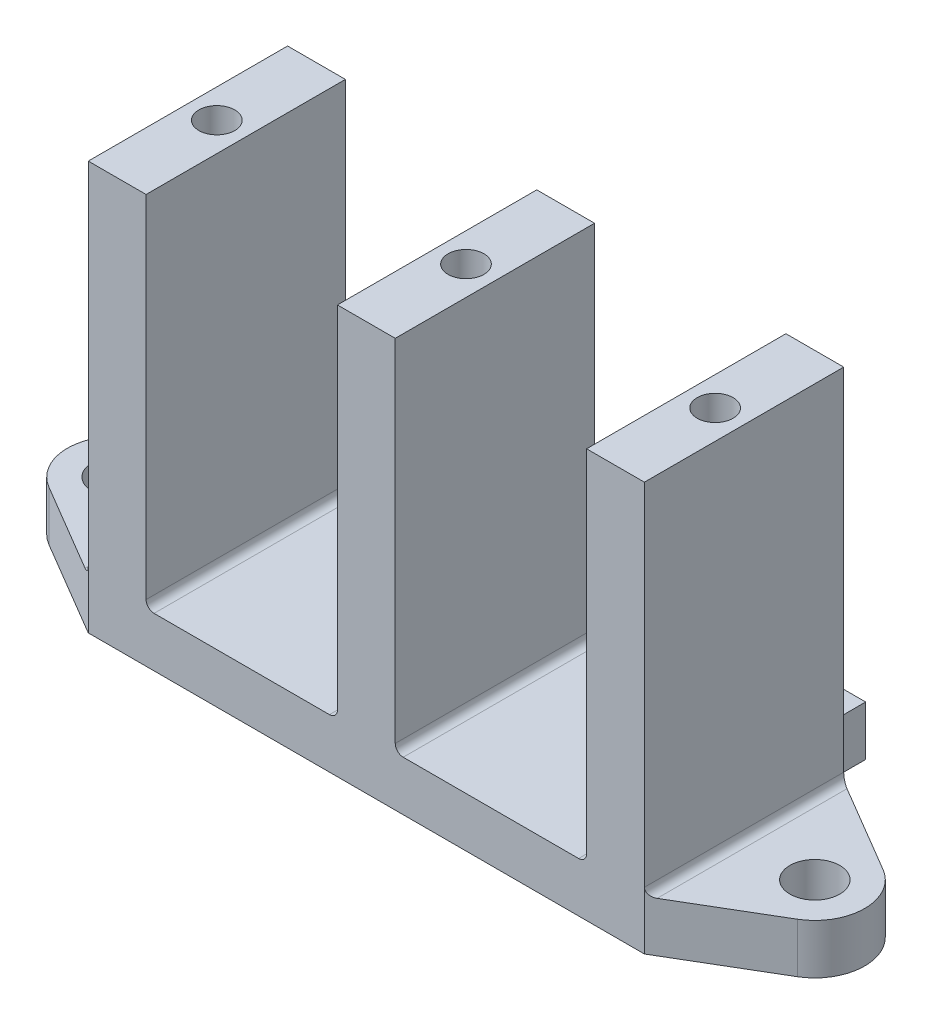
from build123d import *

# Parameters (mm, degrees)
SKETCH1_W             = 3.683
SKETCH1_H             = 12.7
BOSS_EXTRUDE1_DEPTH   = 22.86
BOSS_EXTRUDE1_2_DEPTH = 22.86
BOSS_EXTRUDE1_3_DEPTH = 22.86
SKETCH2_R             = 1.5875
BOSS_EXTRUDE2_DEPTH   = 3.175
FILLET1_R             = 0.508
SKETCH3_R             = 1.143
CUT_EXTRUDE1_DEPTH    = 12.7
SKETCH4_W             = 12.192
SKETCH4_H             = 3.175
BOSS_EXTRUDE3_DEPTH   = 5.08
FILLET2_R             = 1.5875


with BuildPart() as part:
    # Sketch1 → Boss-Extrude1 (new body)
    with BuildSketch(Plane(origin=(0, 0, 0), x_dir=(1, 0, 0), z_dir=(0, 1, 0))):
        Rectangle(SKETCH1_W, SKETCH1_H)
    extrude(amount=BOSS_EXTRUDE1_DEPTH)



with BuildPart() as body_2:
    # Sketch1 → Boss-Extrude1 2 (new body)
    with BuildSketch(Plane(origin=(0, 0, 0), x_dir=(1, 0, 0), z_dir=(0, 1, 0))):
        with Locations((-15.875, 0)):
            Rectangle(SKETCH1_W, SKETCH1_H)
    extrude(amount=BOSS_EXTRUDE1_2_DEPTH)


with BuildPart() as body_3:
    # Sketch1 → Boss-Extrude1 3 (new body)
    with BuildSketch(Plane(origin=(0, 0, 0), x_dir=(1, 0, 0), z_dir=(0, 1, 0))):
        with Locations((15.875, 0)):
            Rectangle(SKETCH1_W, SKETCH1_H)
    extrude(amount=BOSS_EXTRUDE1_3_DEPTH)


with BuildPart() as part_1:
    add(part.part)

    add(body_2.part)  # Boss-Extrude2 merges body 2

    add(body_3.part)  # Boss-Extrude2 merges body 3
    # Sketch2 → Boss-Extrude2 (add)
    with BuildSketch(Plane(origin=(0, 0, 0), x_dir=(1, 0, 0), z_dir=(0, 1, 0))):
        with BuildLine():
            Line((-23.839553388, -2.733832906), (-17.7165, -6.35))
            Line((-17.7165, -6.35), (17.7165, -6.35))
            Line((17.7165, -6.35), (17.7165, 6.35))
            Line((17.7165, 6.35), (-17.7165, 6.35))
            Line((-17.7165, 6.35), (-23.839553388, 2.733832906))
            ThreePointArc((-23.839553388, 2.733832906), (-25.4, 0), (-23.839553388, -2.733832906))
        make_face()
        with Locations(Location((-22.225, 0, 0), (0, 0, 270))):
            Circle(SKETCH2_R, mode=Mode.SUBTRACT)
    boss_extrude2 = extrude(amount=-BOSS_EXTRUDE2_DEPTH)

    # Mirror1: Boss-Extrude2 across plane
    add(boss_extrude2.mirror(Plane(origin=(0, 0, 0), x_dir=(0, 0, 1), z_dir=(1, 0, 0))))

    # Fillet1
    fillet1_edges = [part_1.edges().sort_by_distance(p)[0] for p in [
        (-14.0335, 0, 0),
        (-17.7165, 0, 0),
        (14.0335, 0, 0),
        (-1.8415, 0, 0),
        (17.7165, 0, 0),
        (1.8415, 0, 0),
    ]]
    fillet(fillet1_edges, radius=FILLET1_R)

    # Sketch3 → Cut-Extrude1 (cut)
    with BuildSketch(Plane(origin=(0, 22.86, 0), x_dir=(1, 0, 0), z_dir=(0, 1, 0))):
        with Locations(Location((15.875, 0, 0), (0, 0, 270))):
            Circle(SKETCH3_R)
        with Locations(Location((0, 0, 0), (0, 0, 270))):
            Circle(SKETCH3_R)
        with Locations(Location((-15.875, 0, 0), (0, 0, 270))):
            Circle(SKETCH3_R)
    extrude(amount=-CUT_EXTRUDE1_DEPTH, mode=Mode.SUBTRACT)

    # Sketch4 → Boss-Extrude3 (add)
    with BuildSketch(Plane(origin=(0, 0, -6.35), x_dir=(-1, 0, 0), z_dir=(0, 0, -1))):
        with Locations((-7.9375, -1.5875)):
            Rectangle(SKETCH4_W, SKETCH4_H)
    extrude(amount=BOSS_EXTRUDE3_DEPTH)

    # Fillet2
    fillet2_edges = [part_1.edges().sort_by_distance(p)[0] for p in [
        (1.8415, -1.5875, -6.35),
        (14.0335, -1.5875, -6.35),
    ]]
    fillet(fillet2_edges, radius=FILLET2_R)


solid = part_1.part
